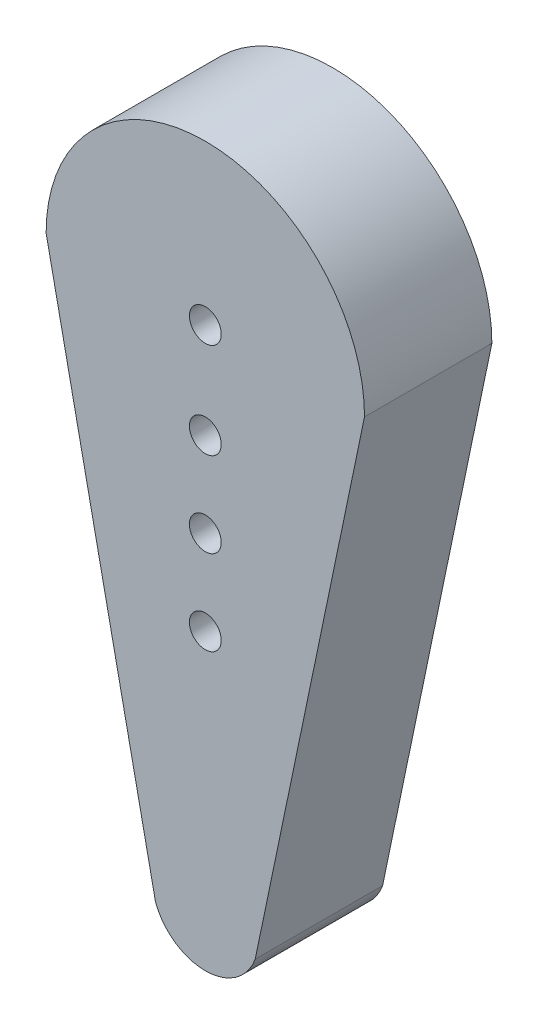
from build123d import *

# Parameters (mm, degrees)
BOSS_EXTRUDE1_DEPTH     = 6
CUT_EXTRUDE3_DEPTH      = 4.7
CUT_EXTRUDE4_DEPTH      = 28.796807371
CUT_EXTRUDE4_DEPTH_BACK = 28.796807371
SKETCH4_R               = 0.75
SKETCH6_R               = 0.75
CUT_EXTRUDE6_DEPTH      = 28.796807371
LPATTERN1_COUNT         = 3
LPATTERN1_PITCH         = 4


with BuildPart() as part:
    # Sketch2 → Boss-Extrude1 (new body)
    with BuildSketch(Plane.XY):
        with BuildLine():
            Line((-7.5, 0), (-2.347339189, -24.710231791))
            ThreePointArc((-2.347339189, -24.710231791), (0.004409749, -26.349996111), (2.350359302, -24.70194551))
            Line((2.350359302, -24.70194551), (7.5, 0))
            ThreePointArc((7.5, 0), (0, 7.5), (-7.5, 0))
        make_face()
    extrude(amount=BOSS_EXTRUDE1_DEPTH)

    # Sketch3 → Cut-Extrude3 (cut)
    with BuildSketch(Plane.XY):
        with BuildLine():
            Line((-3.75, 0), (-2.25, -15))
            ThreePointArc((-2.25, -15), (0, -17.25), (2.25, -15))
            Line((2.25, -15), (3.75, 0))
            ThreePointArc((3.75, 0), (0, 3.75), (-3.75, 0))
        make_face()
    extrude(amount=CUT_EXTRUDE3_DEPTH, mode=Mode.SUBTRACT)

    # Sketch4 → Cut-Extrude4 (cut, two sides: drawn at the far end of the back side and taken through both)
    with BuildSketch(Plane(origin=(0, 0, 4.7), x_dir=(-1, 0, 0), z_dir=(0, 0, -1)).offset(-CUT_EXTRUDE4_DEPTH_BACK)):
        Circle(SKETCH4_R)
    extrude(amount=CUT_EXTRUDE4_DEPTH + CUT_EXTRUDE4_DEPTH_BACK, mode=Mode.SUBTRACT)

    # Sketch6 → Cut-Extrude6 (cut, symmetric)
    with BuildSketch(Plane(origin=(0, 0, 4.7), x_dir=(-1, 0, 0), z_dir=(0, 0, -1))):
        with Locations((0, -4.5)):
            Circle(SKETCH6_R)
    cut_extrude6 = extrude(amount=CUT_EXTRUDE6_DEPTH, both=True, mode=Mode.SUBTRACT)

    # LPattern1: Cut-Extrude6 ×3
    with Locations(*[(0, -i * LPATTERN1_PITCH, 0) for i in range(1, LPATTERN1_COUNT)]):
        add(cut_extrude6, mode=Mode.SUBTRACT)


solid = part.part
